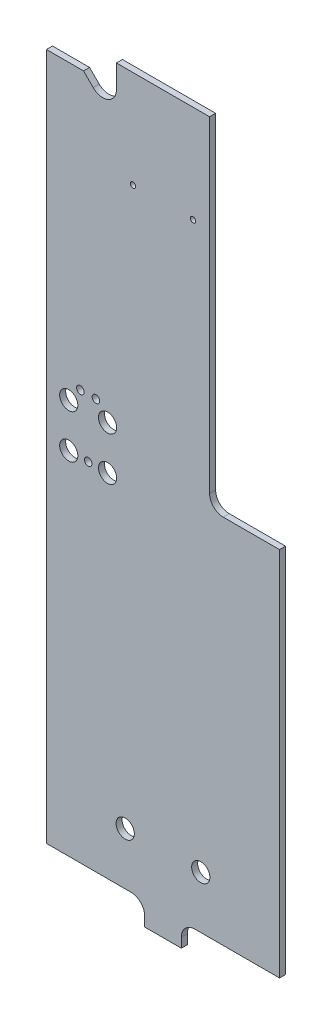
from build123d import *

# Parameters (mm, degrees)
SKETCH3_R           = 0.3556
SKETCH3_R_2         = 1.1938
SKETCH3_R_3         = 1.18749826
SKETCH3_R_4         = 0.49549812
BOSS_EXTRUDE1_DEPTH = 0.7874
SKETCH13_R          = 1.44149826
SKETCH13_R_2        = 0.74949812
SKETCH13_R_3        = 0.6096
SKETCH13_R_4        = 1.4478
BOSS_EXTRUDE4_DEPTH = 0.127


with BuildPart() as part:
    # Sketch3 → Boss-Extrude1 (new body)
    with BuildSketch(Plane.XY):
        with BuildLine():
            Line((7.874, 3.556), (15.24, 3.556))
            Line((15.24, 3.556), (15.24, -44.958))
            Line((15.24, -44.958), (4.1783, -44.958))
            ThreePointArc((4.1783, -44.958), (2.921064143, -45.478764143), (2.4003, -46.736))
            Line((2.4003, -46.736), (2.4003, -48.006))
            Line((2.4003, -48.006), (-2.4003, -48.006))
            Line((-2.4003, -48.006), (-2.4003, -46.736))
            ThreePointArc((-2.4003, -46.736), (-2.921064143, -45.478764143), (-4.1783, -44.958))
            Line((-4.1783, -44.958), (-15.24, -44.958))
            Line((-15.24, -44.958), (-15.24, 44.958))
            Line((-15.24, 44.958), (-10.388471714, 44.958))
            Line((-10.388471714, 44.958), (-9.131235857, 43.700764143))
            ThreePointArc((-9.131235857, 43.700764143), (-7.193588857, 43.315342191), (-6.096, 44.958))
            Line((-6.096, 44.958), (-6.096, 48.006))
            Line((-6.096, 48.006), (6.096, 48.006))
            Line((6.096, 48.006), (6.096, 5.334))
            ThreePointArc((6.096, 5.334), (6.616764143, 4.076764143), (7.874, 3.556))
        make_face()
        with Locations((-3.92557, 35.2552)):
            Circle(SKETCH3_R, mode=Mode.SUBTRACT)
        with Locations((3.92557, 35.2552)):
            Circle(SKETCH3_R, mode=Mode.SUBTRACT)
        with Locations((-4.9403, -38.123756366)):
            Circle(SKETCH3_R_2, mode=Mode.SUBTRACT)
        with Locations((4.9403, -38.123756366)):
            Circle(SKETCH3_R_2, mode=Mode.SUBTRACT)
        with Locations((-12.32662, 0.992243634)):
            Circle(SKETCH3_R_3, mode=Mode.SUBTRACT)
        with Locations((-9.78662, 0.992243634)):
            Circle(SKETCH3_R_4, mode=Mode.SUBTRACT)
        with Locations((-7.24662, 0.992243634)):
            Circle(SKETCH3_R_3, mode=Mode.SUBTRACT)
        with Locations((-7.24662, 6.707243634)):
            Circle(SKETCH3_R_3, mode=Mode.SUBTRACT)
        with Locations((-12.32662, 6.707243634)):
            Circle(SKETCH3_R_3, mode=Mode.SUBTRACT)
        with Locations((-8.77062, 8.612243634)):
            Circle(SKETCH3_R_4, mode=Mode.SUBTRACT)
        with Locations((-10.80262, 8.612243634)):
            Circle(SKETCH3_R_4, mode=Mode.SUBTRACT)
    extrude(amount=-BOSS_EXTRUDE1_DEPTH)


with BuildPart() as body_2:
    # Sketch13 → Boss-Extrude4 (new, symmetric)
    with BuildSketch(Plane.XY.offset(-0.3937)):
        with BuildLine():
            Line((14.986, -44.704), (14.986, 3.302))
            Line((14.986, 3.302), (7.874, 3.302))
            ThreePointArc((7.874, 3.302), (6.437159021, 3.897159021), (5.842, 5.334))
            Line((5.842, 5.334), (5.842, 47.752))
            Line((5.842, 47.752), (-5.842, 47.752))
            Line((-5.842, 47.752), (-5.842, 44.958))
            ThreePointArc((-5.842, 44.958), (-7.096387265, 43.08067679), (-9.310840979, 43.521159021))
            Line((-9.310840979, 43.521159021), (-10.493681959, 44.704))
            Line((-10.493681959, 44.704), (-14.986, 44.704))
            Line((-14.986, 44.704), (-14.986, -44.704))
            Line((-14.986, -44.704), (-4.1783, -44.704))
            ThreePointArc((-4.1783, -44.704), (-2.741459021, -45.299159021), (-2.1463, -46.736))
            Line((-2.1463, -46.736), (-2.1463, -47.752))
            Line((-2.1463, -47.752), (2.1463, -47.752))
            Line((2.1463, -47.752), (2.1463, -46.736))
            ThreePointArc((2.1463, -46.736), (2.741459021, -45.299159021), (4.1783, -44.704))
            Line((4.1783, -44.704), (14.986, -44.704))
        make_face()
        with Locations((-7.24662, 0.992243634)):
            Circle(SKETCH13_R, mode=Mode.SUBTRACT)
        with Locations((-9.78662, 0.992243634)):
            Circle(SKETCH13_R_2, mode=Mode.SUBTRACT)
        with Locations((-12.32662, 0.992243634)):
            Circle(SKETCH13_R, mode=Mode.SUBTRACT)
        with Locations((-10.80262, 8.612243634)):
            Circle(SKETCH13_R_2, mode=Mode.SUBTRACT)
        with Locations((-8.77062, 8.612243634)):
            Circle(SKETCH13_R_2, mode=Mode.SUBTRACT)
        with Locations((-12.32662, 6.707243634)):
            Circle(SKETCH13_R, mode=Mode.SUBTRACT)
        with Locations((-7.24662, 6.707243634)):
            Circle(SKETCH13_R, mode=Mode.SUBTRACT)
        with Locations((3.92557, 35.2552)):
            Circle(SKETCH13_R_3, mode=Mode.SUBTRACT)
        with Locations((-3.92557, 35.2552)):
            Circle(SKETCH13_R_3, mode=Mode.SUBTRACT)
        with Locations((4.9403, -38.123756366)):
            Circle(SKETCH13_R_4, mode=Mode.SUBTRACT)
        with Locations((-4.9403, -38.123756366)):
            Circle(SKETCH13_R_4, mode=Mode.SUBTRACT)
    extrude(amount=BOSS_EXTRUDE4_DEPTH, both=True)


solid = Compound([part.part, body_2.part])
